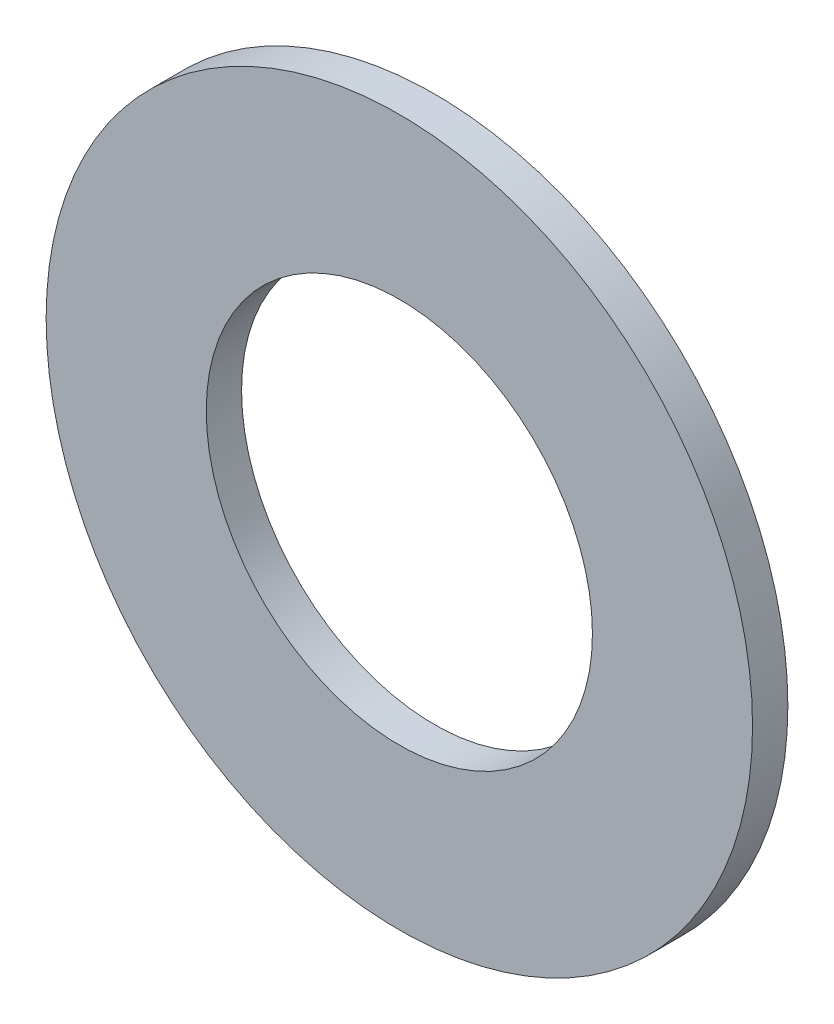
from build123d import *

# Parameters (mm, degrees)
SKETCH1_R           = 7.5
SKETCH1_R_2         = 4.1
BOSS_EXTRUDE1_DEPTH = 0.75


with BuildPart() as part:
    # Sketch1 → Boss-Extrude1 (new body)
    with BuildSketch(Plane.XY):
        Circle(SKETCH1_R)
        Circle(SKETCH1_R_2, mode=Mode.SUBTRACT)
    extrude(amount=BOSS_EXTRUDE1_DEPTH)


solid = part.part
